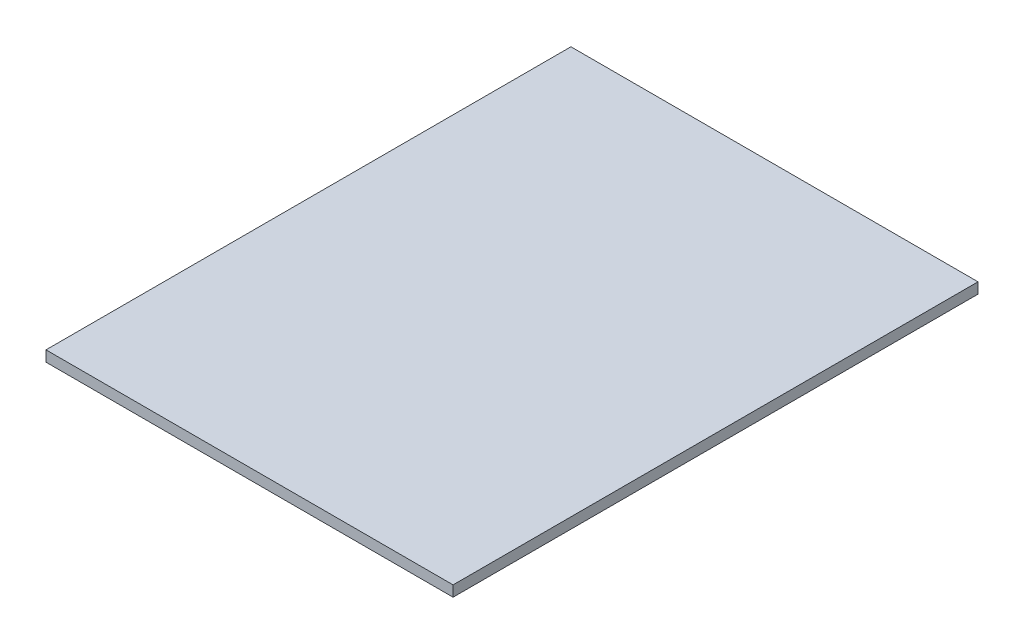
from build123d import *

# Parameters (mm, degrees)
SKETCH1_W           = 482.6
SKETCH1_H           = 622.3
BOSS_EXTRUDE1_DEPTH = 12.7


with BuildPart() as part:
    # Sketch1 → Boss-Extrude1 (new body)
    with BuildSketch(Plane(origin=(0, 0, 0), x_dir=(1, 0, 0), z_dir=(0, 1, 0))):
        Rectangle(SKETCH1_W, SKETCH1_H)
    extrude(amount=BOSS_EXTRUDE1_DEPTH)


solid = part.part
